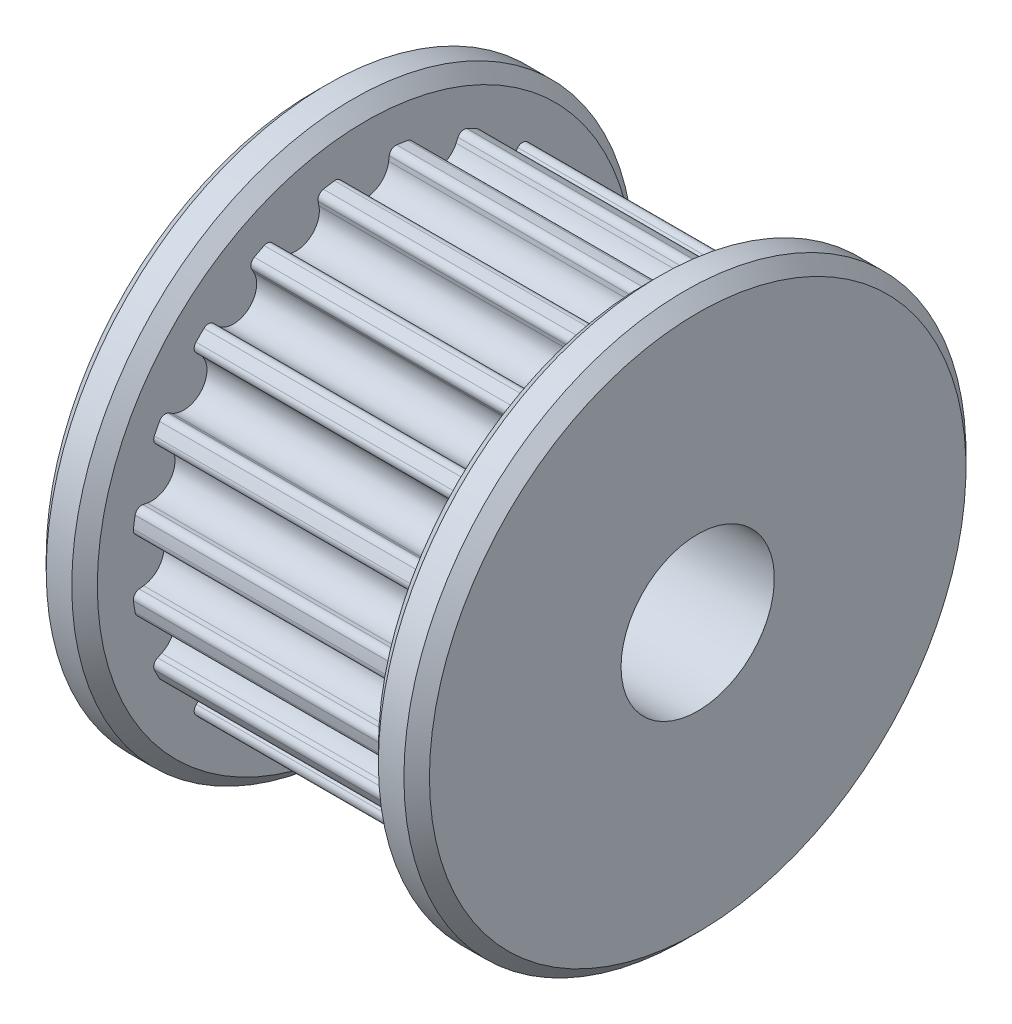
from build123d import *

# Parameters (mm, degrees)
SKETCH_1_W               = 11
SKETCH_1_H               = 6.169
CUT_EXTRUDE_2_REACH      = 19.004
PATTERN_CIRCULAR_3_COUNT = 20
EXTRUDE_START            = 2
SKETCH_7_R               = 11
SKETCH_7_R_2             = 3
EXTRUDE_1_DEPTH          = 2
EXTRUDE_START_2          = -11
SKETCH_7_2_R             = 11
SKETCH_7_2_R_2           = 3
EXTRUDE_2_DEPTH          = 2
CHAMFER_1_SIZE           = 0.5


with BuildPart() as part:
    # 草图1 → 旋转1 (revolve)
    with BuildSketch(Plane.XY, mode=Mode.PRIVATE) as revolve_1_sk:
        with Locations((5.5, 6.0845)):
            Rectangle(SKETCH_1_W, SKETCH_1_H)
    revolve(revolve_1_sk.sketch.rotate(Axis((0, 0, 0), (1, 0, 0)), 90), axis=Axis((0, 0, 0), (1, 0, 0)))

    # 草图6 → 切除-拉伸2 (cut, up to next)
    with BuildSketch(Plane(origin=(0, 0, 0), x_dir=(0, 0, -1), z_dir=(1, 0, 0)), mode=Mode.PRIVATE) as cut_extrude_2_sk1:
        with BuildLine():
            Line((0.924550348, 8.86184509), (0.903216998, 8.688098898))
            ThreePointArc((0.903216998, 8.688098898), (0, 7.889), (-0.903216998, 8.688098898))
            Line((-0.903216998, 8.688098898), (-0.924550348, 8.86184509))
            ThreePointArc((-0.924550348, 8.86184509), (-1.023665877, 9.035916247), (-1.217125672, 9.087858169))
            ThreePointArc((-1.217125672, 9.087858169), (-1.345852886, 9.069688033), (-1.47430954, 9.049694601))
            Line((-1.47430954, 9.049694601), (-1.670957529, 10.651263944))
            ThreePointArc((-1.670957529, 10.651263944), (0, 10.781536192), (1.670957529, 10.651263944))
            Line((1.670957529, 10.651263944), (1.47430954, 9.049694601))
            ThreePointArc((1.47430954, 9.049694601), (1.345852886, 9.069688033), (1.217125672, 9.087858169))
            ThreePointArc((1.217125672, 9.087858169), (1.023665877, 9.035916247), (0.924550348, 8.86184509))
        make_face()
    cut_extrude_2_tool1 = extrude(cut_extrude_2_sk1.sketch, amount=CUT_EXTRUDE_2_REACH, mode=Mode.PRIVATE) & part.part
    cut_extrude_2 = cut_extrude_2_tool1.solids().sort_by_distance((0, 9.573328, 0))[0]
    add(cut_extrude_2, mode=Mode.SUBTRACT)

    # 阵列(圆周)3: 切除-拉伸2 ×20 about axis
    pattern_circular_3_axis = Axis((0, 0, 0), (1, 0, 0))
    for i in range(1, PATTERN_CIRCULAR_3_COUNT):
        add(cut_extrude_2.rotate(pattern_circular_3_axis, i * 360 / PATTERN_CIRCULAR_3_COUNT), mode=Mode.SUBTRACT)

    # 草图7 → 凸台-拉伸1 (add)
    with BuildSketch(Plane.ZY.offset(EXTRUDE_START)):
        Circle(SKETCH_7_R)
        Circle(SKETCH_7_R_2, mode=Mode.SUBTRACT)
    extrude(amount=-EXTRUDE_1_DEPTH)

    # 草图7<2> → 凸台-拉伸2 (add)
    with BuildSketch(Plane.ZY.offset(EXTRUDE_START_2)):
        Circle(SKETCH_7_2_R)
        Circle(SKETCH_7_2_R_2, mode=Mode.SUBTRACT)
    extrude(amount=-EXTRUDE_2_DEPTH)

    # 倒角1
    chamfer_1_edges = [part.edges().sort_by_distance(p)[0] for p in [
        (-2, 0, -11),
        (0, 0, -11),
        (13, 0, -11),
        (11, 0, -11),
    ]]
    chamfer(chamfer_1_edges, length=CHAMFER_1_SIZE)


solid = part.part
